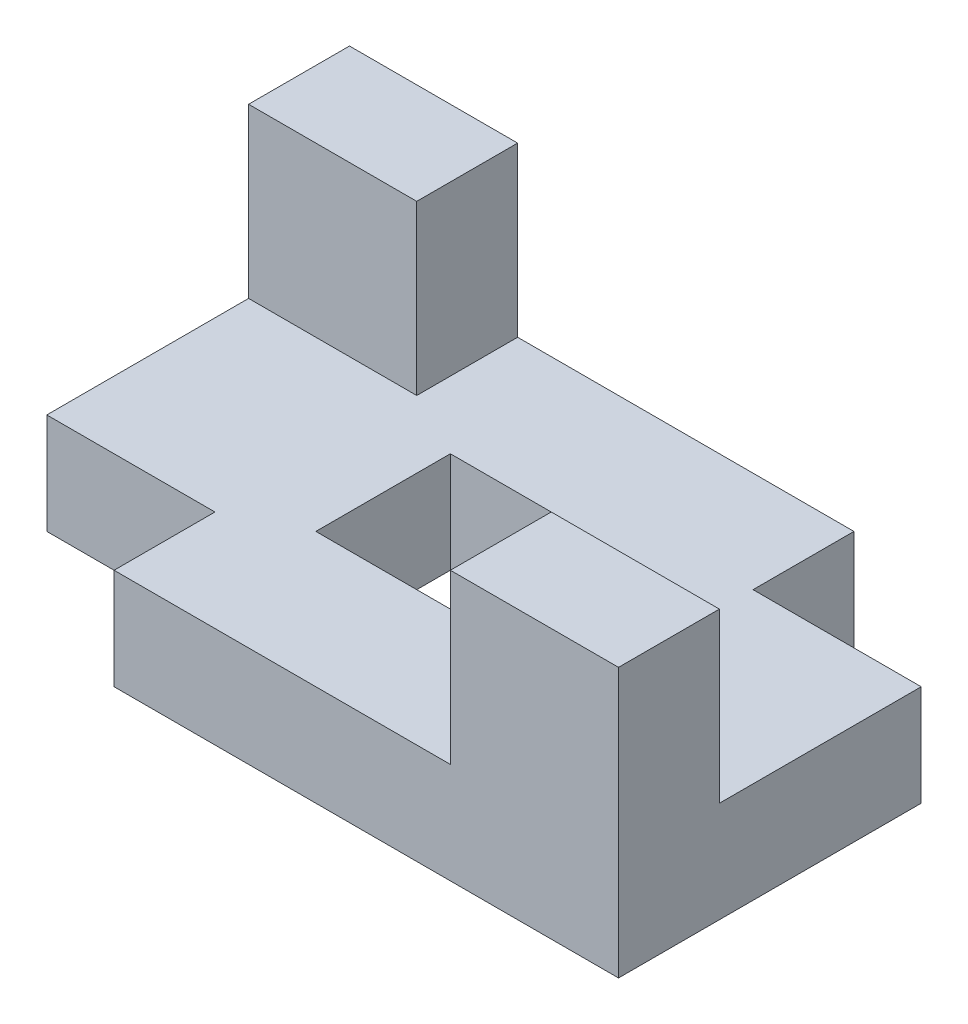
from build123d import *

# Parameters (mm, degrees)
SKETCH1_W           = 100
SKETCH1_H           = 60
BOSS_EXTRUDE1_DEPTH = 15
SKETCH2_W           = 25
SKETCH2_H           = 15
BOSS_EXTRUDE2_DEPTH = 25
SKETCH4_W           = 25
SKETCH4_H           = 15
CUT_EXTRUDE1_DEPTH  = 23
SKETCH5_W           = 30
SKETCH5_H           = 20
CUT_EXTRUDE3_DEPTH  = 45


with BuildPart() as part:
    # Sketch1 → Boss-Extrude1 (new body)
    with BuildSketch(Plane(origin=(0, 0, 0), x_dir=(1, 0, 0), z_dir=(0, 1, 0))):
        Rectangle(SKETCH1_W, SKETCH1_H)
    extrude(amount=BOSS_EXTRUDE1_DEPTH)

    # Sketch2 → Boss-Extrude2 (add)
    with BuildSketch(Plane(origin=(0, 15, 0), x_dir=(1, 0, 0), z_dir=(0, 1, 0))):
        with Locations((-37.5, 22.5)):
            Rectangle(SKETCH2_W, SKETCH2_H)
        with Locations((37.5, -22.5)):
            Rectangle(SKETCH2_W, SKETCH2_H)
    extrude(amount=BOSS_EXTRUDE2_DEPTH)

    # Sketch4 → Cut-Extrude1 (cut)
    with BuildSketch(Plane(origin=(0, 15, 0), x_dir=(1, 0, 0), z_dir=(0, 1, 0))):
        with Locations((-37.5, -22.5)):
            Rectangle(SKETCH4_W, SKETCH4_H)
        with Locations((37.5, 22.5)):
            Rectangle(SKETCH4_W, SKETCH4_H)
    extrude(amount=-CUT_EXTRUDE1_DEPTH, mode=Mode.SUBTRACT)

    # Sketch5 → Cut-Extrude3 (cut)
    with BuildSketch(Plane(origin=(0, 15, 0), x_dir=(1, 0, 0), z_dir=(0, 1, 0))):
        Rectangle(SKETCH5_W, SKETCH5_H)
    extrude(amount=-CUT_EXTRUDE3_DEPTH, mode=Mode.SUBTRACT)


solid = part.part
